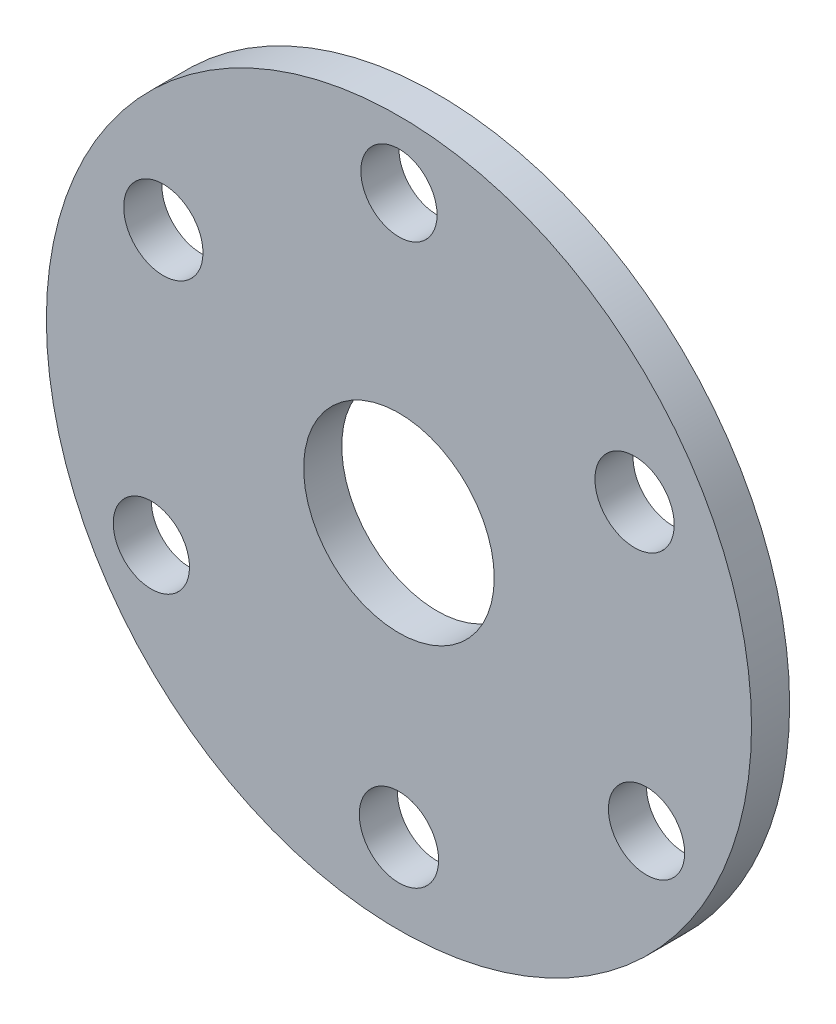
from build123d import *

# Parameters (mm, degrees)
SKETCH_1_R      = 18.5
SKETCH_1_R_2    = 5
SKETCH_1_R_3    = 2
SKETCH_1_R_4    = 2.08
EXTRUDE_1_DEPTH = 2


with BuildPart() as part:
    # 草图1 → 凸台-拉伸1 (new body)
    with BuildSketch(Plane.XY):
        Circle(SKETCH_1_R)
        Circle(SKETCH_1_R_2, mode=Mode.SUBTRACT)
        with Locations((0, 15)):
            Circle(SKETCH_1_R_3, mode=Mode.SUBTRACT)
        with Locations((12.990381057, -7.5)):
            Circle(SKETCH_1_R_3, mode=Mode.SUBTRACT)
        with Locations((-12.990381057, -7.5)):
            Circle(SKETCH_1_R_3, mode=Mode.SUBTRACT)
        with Locations((-12.36258754, 7.137543244)):
            Circle(SKETCH_1_R_4, mode=Mode.SUBTRACT)
        with Locations((12.36258754, 7.137543244)):
            Circle(SKETCH_1_R_4, mode=Mode.SUBTRACT)
        with Locations((0, -14.275086489)):
            Circle(SKETCH_1_R_4, mode=Mode.SUBTRACT)
    extrude(amount=EXTRUDE_1_DEPTH)


solid = part.part
